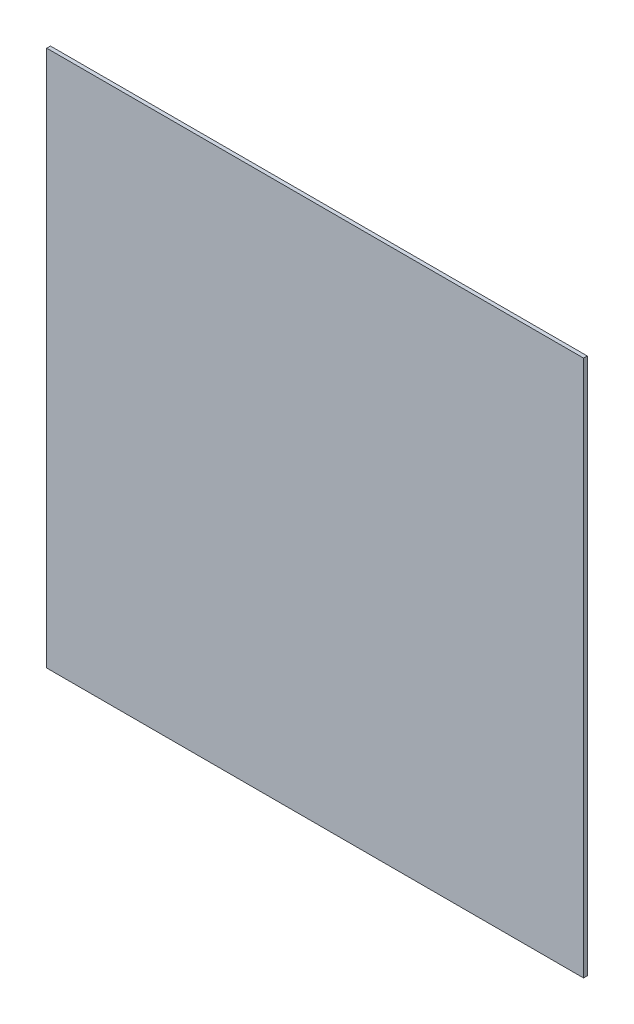
from build123d import *

# Parameters (mm, degrees)
SKETCH1_W           = 457.2
SKETCH1_H           = 457.2
BOSS_EXTRUDE1_DEPTH = 3.175


with BuildPart() as part:
    # Sketch1 → Boss-Extrude1 (new body)
    with BuildSketch(Plane.XY):
        Rectangle(SKETCH1_W, SKETCH1_H)
    extrude(amount=BOSS_EXTRUDE1_DEPTH)


solid = part.part
